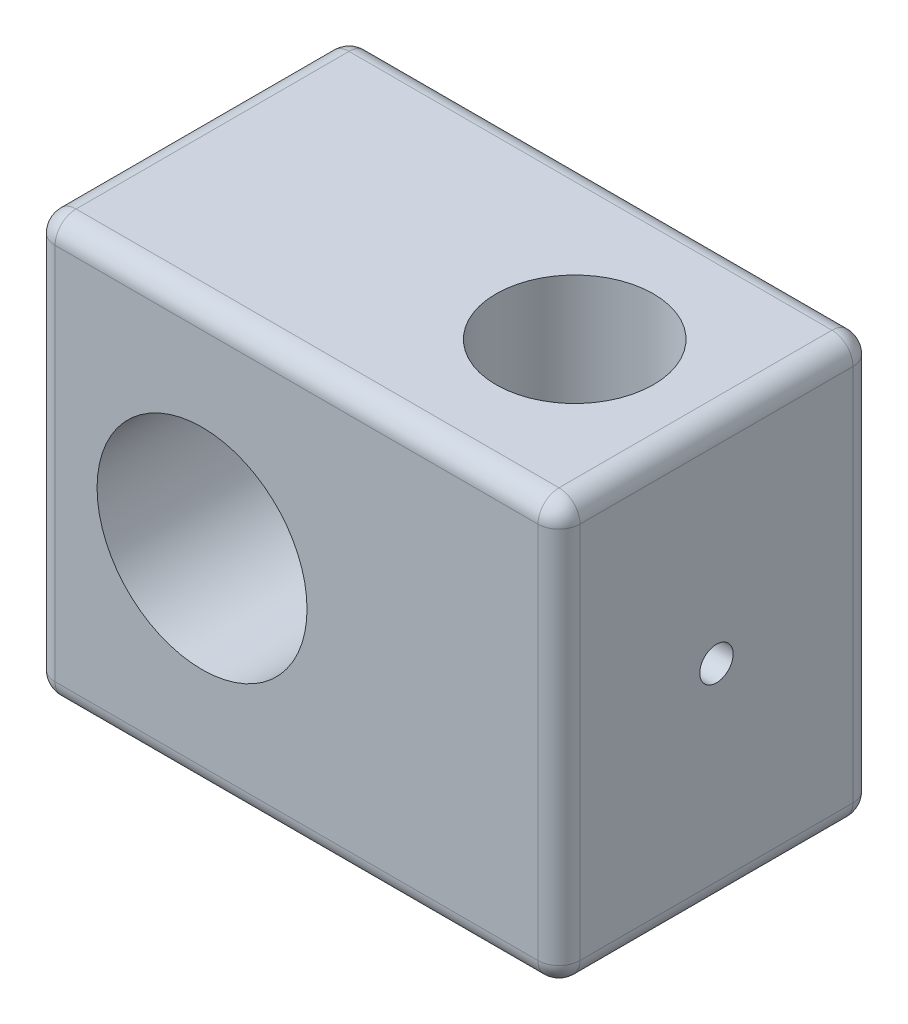
from build123d import *

# Parameters (mm, degrees)
CROQUIS1_W                   = 63.5
CROQUIS1_H                   = 38.1
SALIENTE_EXTRUIR1_DEPTH      = 50.8
CROQUIS2_R                   = 12.7
CORTAR_EXTRUIR1_DEPTH        = 63.5
CROQUIS3_R                   = 9.525
CORTAR_EXTRUIR2_DEPTH        = 63.5
REDONDEO1_R                  = 2.54
TALADRO_ROSCADO_10_322_D     = 4.0386
TALADRO_ROSCADO_10_322_DEPTH = 13.6144
TALADRO_ROSCADO_10_322_TIP   = 1.213317848
TALADRO_ROSCADO_10_321_D     = 4.0386
TALADRO_ROSCADO_10_321_DEPTH = 13.6144
TALADRO_ROSCADO_10_321_TIP   = 1.213317848


with BuildPart() as part:
    # Croquis1 → Saliente-Extruir1 (new body)
    with BuildSketch(Plane(origin=(0, 0, 0), x_dir=(1, 0, 0), z_dir=(0, 1, 0))):
        Rectangle(CROQUIS1_W, CROQUIS1_H)
    extrude(amount=SALIENTE_EXTRUIR1_DEPTH)

    # Croquis2 → Cortar-Extruir1 (cut)
    with BuildSketch(Plane.XY.offset(19.05)):
        with Locations((-11.43, 25.4)):
            Circle(CROQUIS2_R)
    extrude(amount=-CORTAR_EXTRUIR1_DEPTH, mode=Mode.SUBTRACT)

    # Croquis3 → Cortar-Extruir2 (cut)
    with BuildSketch(Plane(origin=(0, 50.8, 0), x_dir=(1, 0, 0), z_dir=(0, 1, 0))):
        with Locations(Location((14.605, 0, 0), (0, 0, 270))):
            Circle(CROQUIS3_R)
    extrude(amount=-CORTAR_EXTRUIR2_DEPTH, mode=Mode.SUBTRACT)

    # Redondeo1
    redondeo1_edges = [part.edges().sort_by_distance(p)[0] for p in [
        (-31.75, 50.8, 0),
        (0, 50.8, 19.05),
        (31.75, 50.8, 0),
        (0, 0, 19.05),
        (-31.75, 0, 0),
        (0, 0, -19.05),
        (31.75, 0, 0),
        (0, 50.8, -19.05),
        (31.75, 25.4, 19.05),
        (-31.75, 25.4, 19.05),
        (-31.75, 25.4, -19.05),
        (31.75, 25.4, -19.05),
    ]]
    fillet(redondeo1_edges, radius=REDONDEO1_R)

    # Taladro roscado #10-322
    with Locations(Plane(origin=(31.75, 0, 0), x_dir=(0, 0, -1), z_dir=(1, 0, 0))):
        with Locations((0, 25.4)):
            Hole(TALADRO_ROSCADO_10_322_D / 2, depth=TALADRO_ROSCADO_10_322_DEPTH)
            with Locations((0, 0, -(TALADRO_ROSCADO_10_322_DEPTH + TALADRO_ROSCADO_10_322_TIP / 2))):  # 118° drill point
                Cone(0, TALADRO_ROSCADO_10_322_D / 2, TALADRO_ROSCADO_10_322_TIP, mode=Mode.SUBTRACT)

    # Taladro roscado #10-321
    with Locations(Plane.ZY.offset(31.75)):
        with Locations((0, 25.4)):
            Hole(TALADRO_ROSCADO_10_321_D / 2, depth=TALADRO_ROSCADO_10_321_DEPTH)
            with Locations((0, 0, -(TALADRO_ROSCADO_10_321_DEPTH + TALADRO_ROSCADO_10_321_TIP / 2))):  # 118° drill point
                Cone(0, TALADRO_ROSCADO_10_321_D / 2, TALADRO_ROSCADO_10_321_TIP, mode=Mode.SUBTRACT)


solid = part.part
